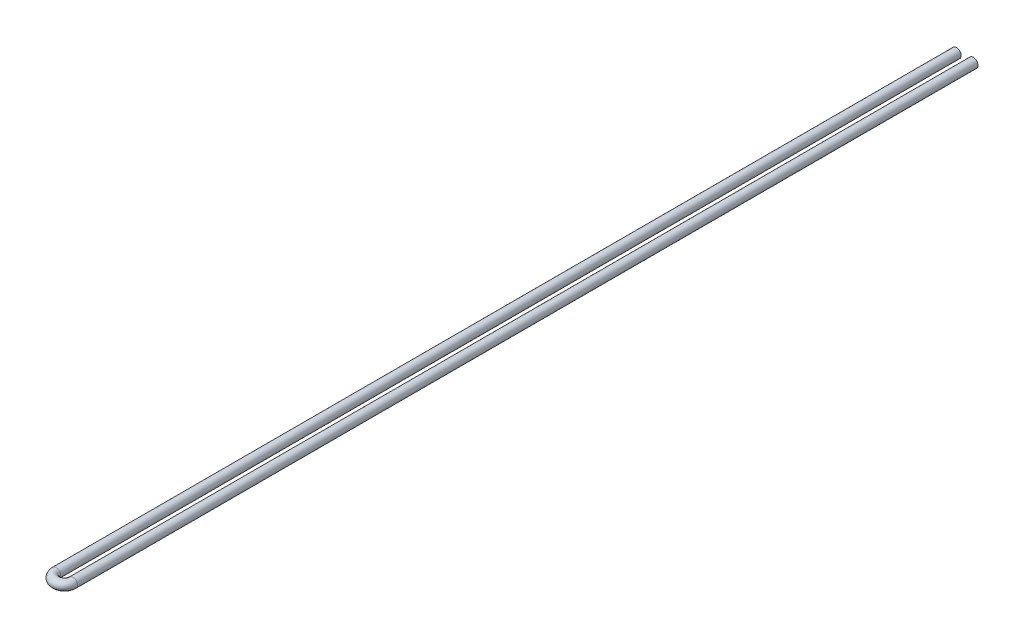
from build123d import *

# Parameters (mm, degrees)
SKETCH2_R   = 11.1
SKETCH2_R_2 = 9.95


with BuildPart() as part:
    # Sweep1: sweep along a path in Sketch1
    with BuildLine(Plane(origin=(0, 0, 0), x_dir=(1, 0, 0), z_dir=(0, 1, 0))) as sweep1_path:
        Line((0, -300), (0, -2440))
        ThreePointArc((0, -2440), (-20, -2460), (-40, -2440))
        Line((-40, -2440), (-40, -300))
    # Sketch2 → Sweep1 (sweep)
    with BuildSketch(Plane(origin=(0, 0, 300), x_dir=(-1, 0, 0), z_dir=(0, 0, -1))):
        Circle(SKETCH2_R)
        Circle(SKETCH2_R_2, mode=Mode.SUBTRACT)
    sweep(path=sweep1_path.line)


solid = part.part
